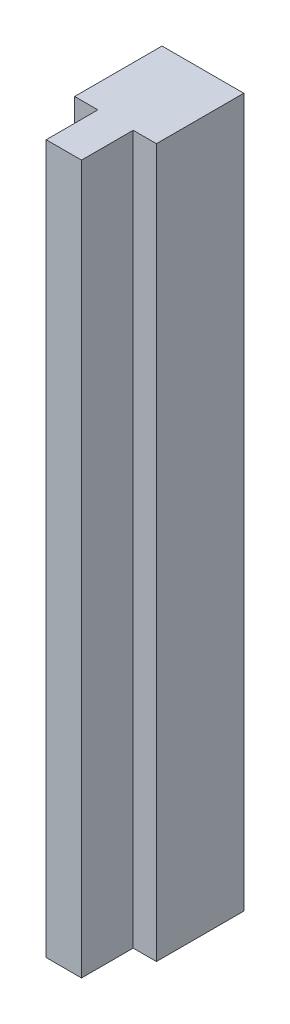
from build123d import *

# Parameters (mm, degrees)
SKETCH_1_W            = 5
SKETCH_1_H            = 5
EXTRUDE_1_DEPTH       = 38.1
SKETCH_3_W            = 2
SKETCH_3_H            = 2.78
EXTRUDE_2_DEPTH       = 38.1
SKETCH_6_W            = 5
SKETCH_6_H            = 5
SKETCH_6_W_2          = 4.4
SKETCH_6_H_2          = 4.4
CUT_EXTRUDE_1_DEPTH   = 39.545277272
EXTRUDE_3_DEPTH       = 38.1
SKETCH_9_W            = 0.05
SKETCH_9_H            = 2.78
CUT_EXTRUDE_1_2_DEPTH = 39.526982752
SKETCH_11_W           = 0.05
SKETCH_11_H           = 2.78
CUT_EXTRUDE_2_DEPTH   = 39.526982752


with BuildPart() as part:
    # 草圖1 → 填料-伸長1 (new body)
    with BuildSketch(Plane(origin=(0, 0, 0), x_dir=(1, 0, 0), z_dir=(0, 1, 0))):
        Rectangle(SKETCH_1_W, SKETCH_1_H)
    extrude(amount=EXTRUDE_1_DEPTH)

    # 草圖3 → 填料-伸長2 (add)
    with BuildSketch(Plane(origin=(0, 38.1, 0), x_dir=(1, 0, 0), z_dir=(0, 1, 0))):
        with Locations((0, -3.89)):
            Rectangle(SKETCH_3_W, SKETCH_3_H)
    extrude(amount=-EXTRUDE_2_DEPTH)

    # 草圖6 → Cut-Extrude 1 (cut, through all)
    with BuildSketch(Plane.XZ):
        Rectangle(SKETCH_6_W, SKETCH_6_H)
        Rectangle(SKETCH_6_W_2, SKETCH_6_H_2, mode=Mode.SUBTRACT)
    extrude(amount=-CUT_EXTRUDE_1_DEPTH, mode=Mode.SUBTRACT)


with BuildPart() as cut_extrude_1_piece_1:
    # of the separate pieces the step leaves, piece 1, a body of its own (cut_extrude_1_pieces)
    add(part.part.solids().sort_by_distance((2.2, 0, 2.2))[0])



with BuildPart() as cut_extrude_1_piece_2:
    # of the separate pieces the step leaves, piece 2, a body of its own (cut_extrude_1_pieces)
    add(part.part.solids().sort_by_distance((-1, 0, 5.28))[0])


with BuildPart() as cut_extrude_1_piece_1_1:
    add(cut_extrude_1_piece_1.part)

    add(cut_extrude_1_piece_2.part)  # 填料-伸長3 merges Cut-Extrude 1 piece 2
    # 草圖8 → 填料-伸長3 (add)
    with BuildSketch(Plane.XZ):
        Polygon((1, 2.5), (2.2, 2.5), (2.2, 2.2), (-2.2, 2.2), (-2.2, 2.5), align=None)
    extrude(amount=-EXTRUDE_3_DEPTH)

    # 草圖9 → Cut-Extrude 1 2 (cut, through all)
    with BuildSketch(Plane.XZ):
        with Locations((-0.975, 3.89)):
            Rectangle(SKETCH_9_W, SKETCH_9_H)
    extrude(amount=-CUT_EXTRUDE_1_2_DEPTH, mode=Mode.SUBTRACT)

    # 草圖11 → 除料-伸長2 (cut, through all)
    with BuildSketch(Plane.XZ):
        with Locations((0.975, 3.89)):
            Rectangle(SKETCH_11_W, SKETCH_11_H)
    extrude(amount=-CUT_EXTRUDE_2_DEPTH, mode=Mode.SUBTRACT)


solid = cut_extrude_1_piece_1_1.part
